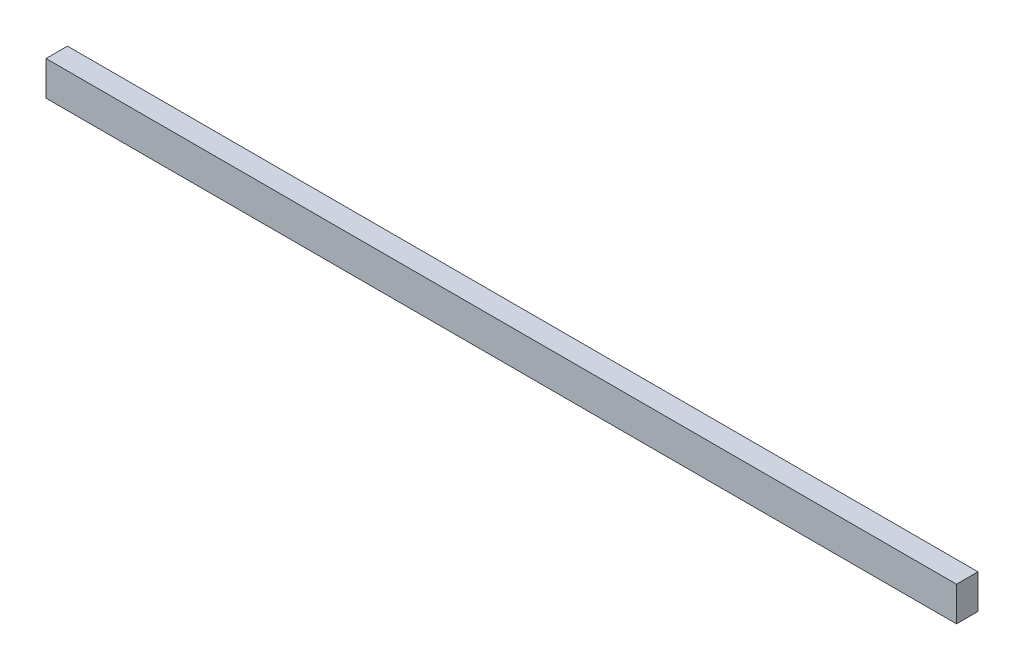
from build123d import *

# Parameters (mm, degrees)
CROQUIS_TRAVESANO_W   = 1060
CROQUIS_TRAVESANO_H   = 25
TRAVESANO_LARGO_DEPTH = 40


with BuildPart() as part:
    # Croquis_travesano → Travesano_largo (new body)
    with BuildSketch(Plane(origin=(0, 0, 0), x_dir=(1, 0, 0), z_dir=(0, 1, 0))):
        Rectangle(CROQUIS_TRAVESANO_W, CROQUIS_TRAVESANO_H)
    extrude(amount=TRAVESANO_LARGO_DEPTH)


solid = part.part
